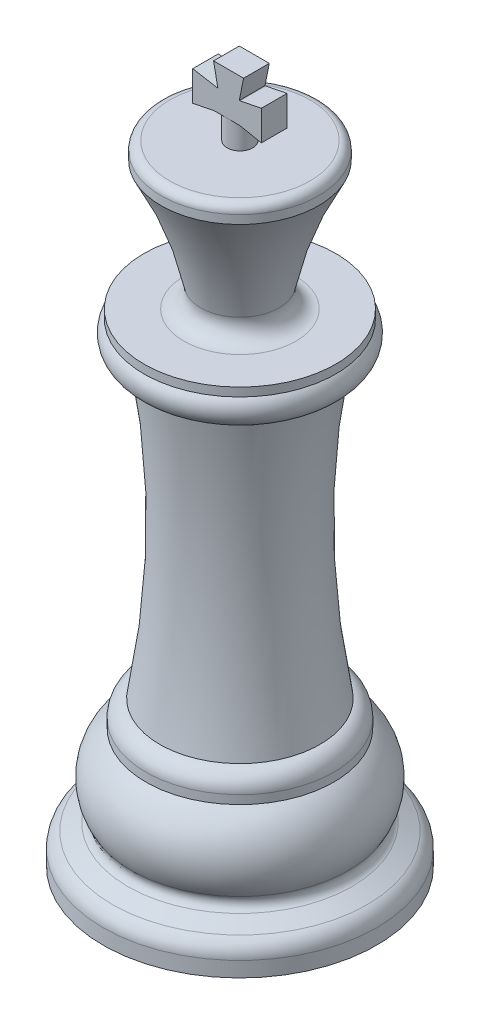
from build123d import *

# Parameters (mm, degrees)
BOSS_EXTRUDE1_DEPTH = 3
FILLET1_R           = 2
FILLET2_R           = 1
FILLET3_R           = 2


with BuildPart() as part:
    # Sketch3 → Revolve1 (revolve)
    with BuildSketch(Plane.XY, mode=Mode.PRIVATE) as revolve1_sk:
        with BuildLine():
            Line((-0.682303149, 68.72), (-0.682303149, -7.57))
            Line((-0.682303149, -7.57), (13.277108949, -7.57))
            Line((13.277108949, -7.57), (15.277108949, -7.57))
            Line((15.277108949, -7.57), (15.277108949, -4.57))
            Line((15.277108949, -4.57), (11.30968923, -2.57))
            ThreePointArc((11.30968923, -2.57), (12.828597915, 2.149281625), (10.277108949, 6.4))
            Line((10.277108949, 6.4), (10.277108949, 7.4))
            ThreePointArc((10.277108949, 7.4), (9.834014283, 8.693451807), (8.663484441, 9.4))
            ThreePointArc((8.663484441, 9.4), (7.03856846, 26.89279186), (8.5, 44.4))
            ThreePointArc((8.5, 44.4), (10.789695479, 45.283075013), (10.5, 47.72))
            Line((10.5, 47.72), (10.5, 48.72))
            Line((10.5, 48.72), (3.5, 48.72))
            ThreePointArc((3.5, 48.72), (5.298648693, 56.453783769), (8.5, 63.72))
            Line((8.5, 63.72), (8.5, 64.72))
            ThreePointArc((8.5, 64.72), (8.207106781, 65.427106781), (7.5, 65.72))
            Line((7.5, 65.72), (0.817696851, 65.72))
            Line((0.817696851, 65.72), (0.817696851, 68.72))
            Line((0.817696851, 68.72), (-0.682303149, 68.72))
        make_face()
    revolve(revolve1_sk.sketch.rotate(Axis((-0.682303149, 68.72, 0), (0, -1, 0)), 180), axis=Axis((-0.682303149, 68.72, 0), (0, -1, 0)))

    # Sketch4 → Boss-Extrude1 (add)
    with BuildSketch(Plane.XY.offset(1.498594167)):
        Polygon((3.317696851, 71.72), (0.817696851, 71.22), (0.74445139, 71.22), (1.24445139, 73.72), (-2.25554861, 73.72), (-1.75554861, 71.22), (-1.828794072, 71.22), (-4.682303149, 71.72), (-4.682303149, 68.22), (-2.182303149, 68.72), (0.817696851, 68.72), (3.317696851, 68.22), align=None)
    extrude(amount=-BOSS_EXTRUDE1_DEPTH)

    # Fillet1
    fillet1_edges = [part.edges().sort_by_distance(p)[0] for p in [
        (15.277108949, -4.57, 0),
    ]]
    fillet(fillet1_edges, radius=FILLET1_R)

    # Fillet2
    fillet2_edges = [part.edges().sort_by_distance(p)[0] for p in [
        (11.30968923, -2.57, 0),
    ]]
    fillet(fillet2_edges, radius=FILLET2_R)

    # Fillet3
    fillet3_edges = [part.edges().sort_by_distance(p)[0] for p in [
        (3.5, 48.72, 0),
    ]]
    fillet(fillet3_edges, radius=FILLET3_R)


solid = part.part
